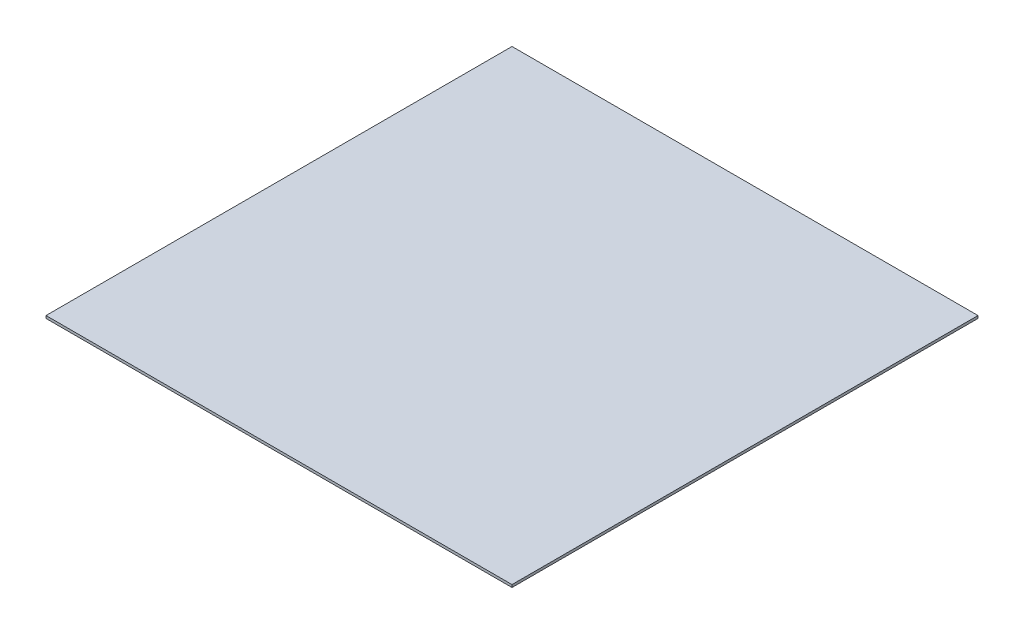
from build123d import *

# Parameters (mm, degrees)
SKETCH1_W           = 546
SKETCH1_H           = 546
BOSS_EXTRUDE1_DEPTH = 3


with BuildPart() as part:
    # Sketch1 → Boss-Extrude1 (new body)
    with BuildSketch(Plane(origin=(0, 0, 0), x_dir=(1, 0, 0), z_dir=(0, 1, 0))):
        Rectangle(SKETCH1_W, SKETCH1_H)
    extrude(amount=BOSS_EXTRUDE1_DEPTH)


solid = part.part
